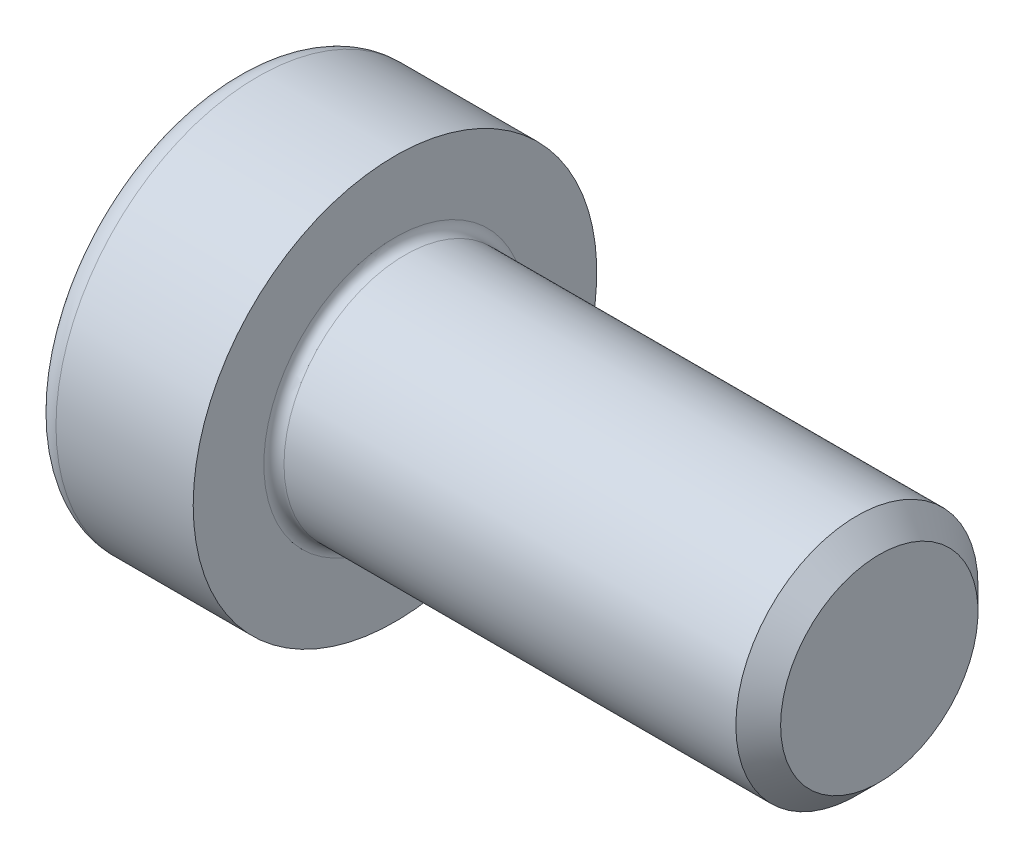
from build123d import *

# Parameters (mm, degrees)
FILLET1_R   = 0.25
FILLET2_R   = 0.6
HEX_2_DEPTH = 3


with BuildPart() as part:
    # BodySke → Base-Revolve (revolve)
    with BuildSketch(Plane.XY, mode=Mode.PRIVATE) as base_revolve_sk:
        Polygon((0, 0), (0, 5), (4, 5), (4, 3), (15.4455, 3), (16, 2.4455), (16, 0), align=None)
    revolve(base_revolve_sk.sketch.rotate(Axis((-31.75, 0, 0), (1, 0, 0)), 90), axis=Axis((-31.75, 0, 0), (1, 0, 0)))

    # Fillet1
    fillet1_edges = [part.edges().sort_by_distance(p)[0] for p in [
        (4, 0, -3),
    ]]
    fillet(fillet1_edges, radius=FILLET1_R)

    # Fillet2
    fillet2_edges = [part.edges().sort_by_distance(p)[0] for p in [
        (0, 0, -5),
    ]]
    fillet(fillet2_edges, radius=FILLET2_R)

    # Sketch2 → Hex-PreBroach (revolve, cut)
    with BuildSketch(Plane.XY, mode=Mode.PRIVATE) as hex_prebroach_sk:
        Polygon((0, 2), (3, 2), (4.154700538, 0), (0, 0), align=None)
    revolve(hex_prebroach_sk.sketch.rotate(Axis((0, 0, 0), (1, 0, 0)), 90), axis=Axis((0, 0, 0), (1, 0, 0)), mode=Mode.SUBTRACT)

    # Sketch3 → Hex 2 (cut)
    with BuildSketch(Plane(origin=(0, 0, 0), x_dir=(0, 0.500000000000001, 0.866025403784438), z_dir=(-1, 0, 0))):
        Polygon((1.154700538, 2), (-1.154700538, 2), (-2.309401077, 0), (-1.154700538, -2), (1.154700538, -2), (2.309401077, 0), align=None)
    extrude(amount=-HEX_2_DEPTH, mode=Mode.SUBTRACT)


solid = part.part
